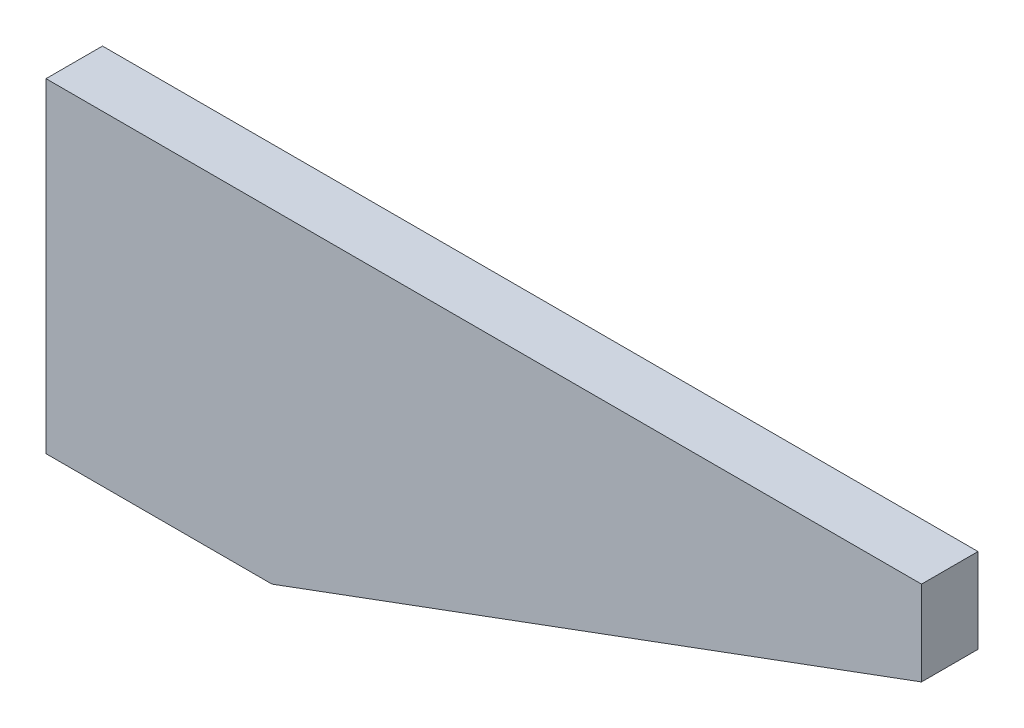
from build123d import *

# Parameters (mm, degrees)
RESSALTO_EXTRUS_O1_DEPTH = 2


with BuildPart() as part:
    # Esboço1 → Ressalto-extrusão1 (new body)
    with BuildSketch(Plane.XY):
        Polygon((-17.456834532, 7.652877698), (-17.456834532, -3.847122302), (-9.456834532, -3.847122302), (13.543165468, 4.652877698), (13.543165468, 7.652877698), align=None)
    extrude(amount=RESSALTO_EXTRUS_O1_DEPTH)


solid = part.part
